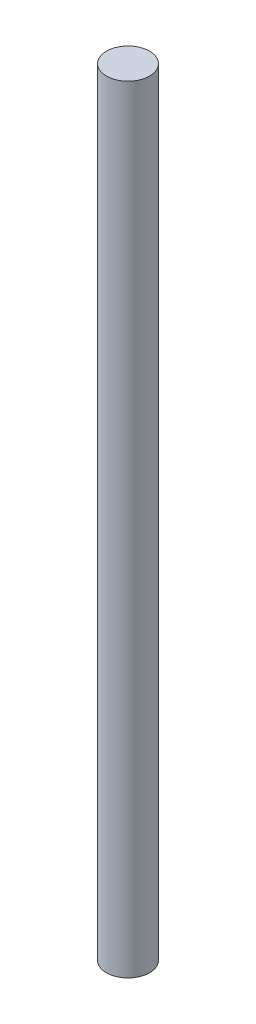
from build123d import *

# Parameters (mm, degrees)
SKETCH_1_R      = 10
EXTRUDE_1_DEPTH = 180


with BuildPart() as part:
    # 草图1 → 凸台-拉伸1 (new, symmetric)
    with BuildSketch(Plane(origin=(0, 0, 0), x_dir=(1, 0, 0), z_dir=(0, 1, 0))):
        with Locations(Location((0, 0, 0), (0, 0, 90))):
            Circle(SKETCH_1_R)
    extrude(amount=EXTRUDE_1_DEPTH, both=True)


solid = part.part
